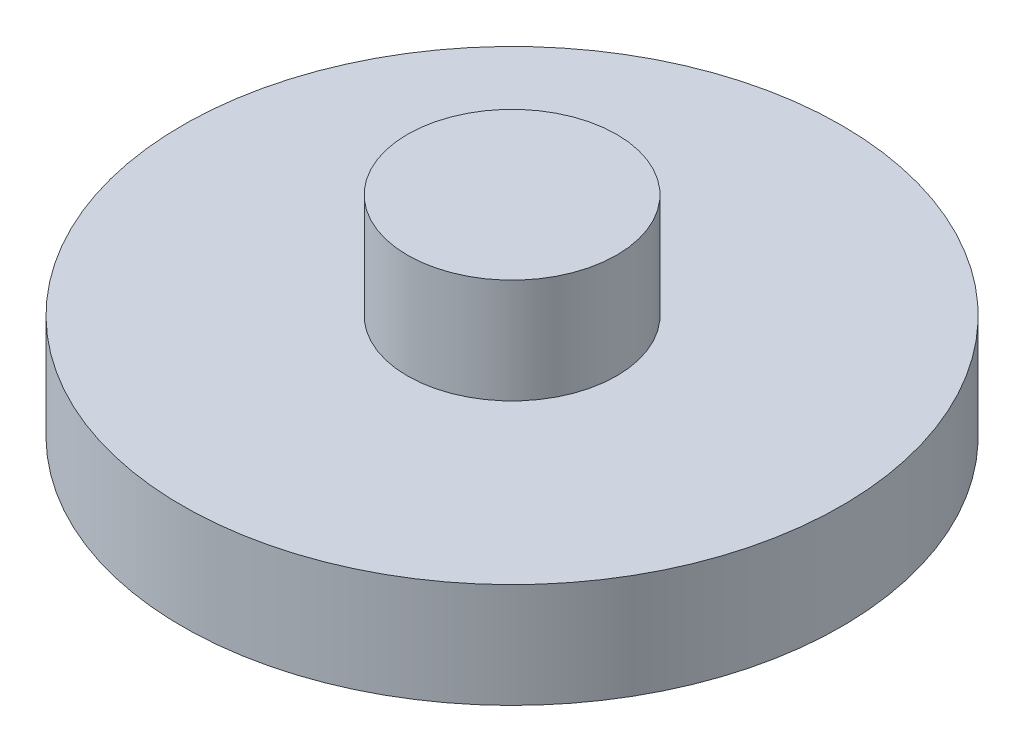
from build123d import *


with BuildPart() as part:
    # Sketch1 → Revolve1 (revolve)
    with BuildSketch(Plane.XY, mode=Mode.PRIVATE) as revolve1_sk:
        Polygon((0, 0), (-15.75, 0), (-15.75, 5), (-5, 5), (-5, 10), (0, 10), align=None)
    revolve(revolve1_sk.sketch.rotate(Axis((0, 0, 0), (0, 1, 0)), 270), axis=Axis((0, 0, 0), (0, 1, 0)))


solid = part.part
